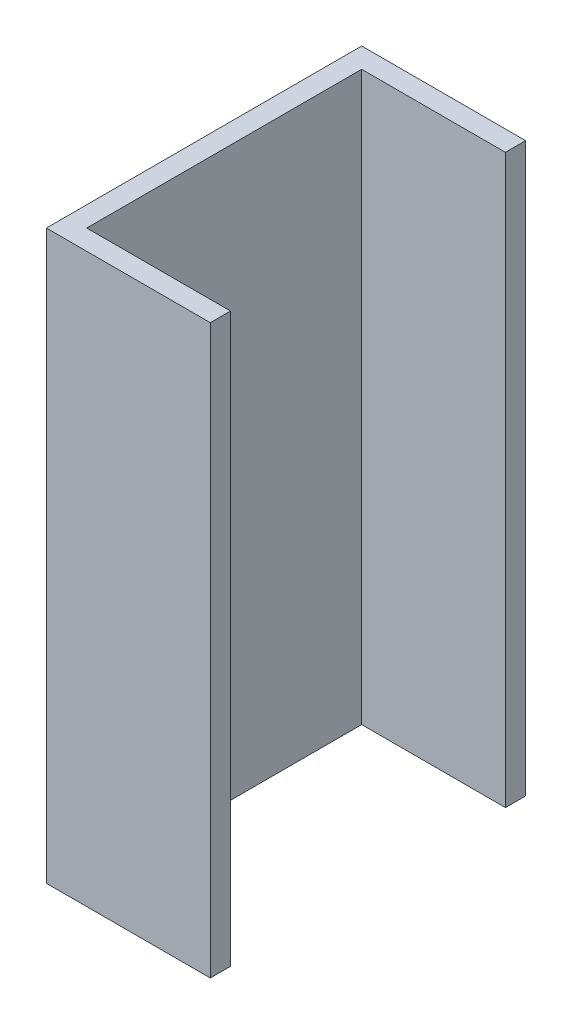
from build123d import *

# Parameters (mm, degrees)
BOSS_EXTRUDE1_DEPTH = 112.5


with BuildPart() as part:
    # Sketch1 → Boss-Extrude1 (new, symmetric)
    with BuildSketch(Plane(origin=(0, 0, 0), x_dir=(1, 0, 0), z_dir=(0, 1, 0))):
        Polygon((0, -62.5), (0, 62.5), (65, 62.5), (65, 54.5), (8, 54.5), (8, -54.5), (65, -54.5), (65, -62.5), align=None)
    extrude(amount=BOSS_EXTRUDE1_DEPTH, both=True)


solid = part.part
